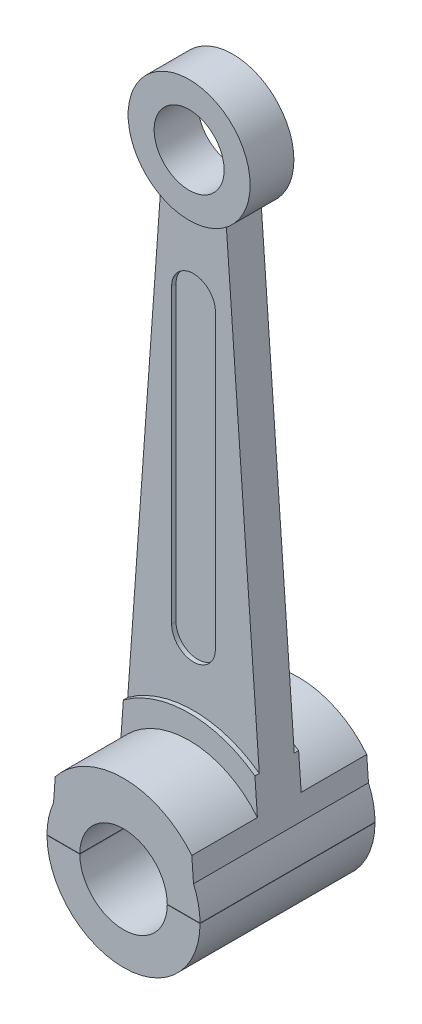
from build123d import *

# Parameters (mm, degrees)
SKETCH1_R                = 35.433
SKETCH1_R_2              = 20.32
BOSS_EXTRUDE1_DEPTH      = 12.7
SKETCH1_R_3              = 64.516
SKETCH1_R_4              = 25.4
BOSS_EXTRUDE1_2_DEPTH    = 12.7
BOSS_EXTRUDE2_DEPTH      = 10.16
BOSS_EXTRUDE3_DEPTH      = 7.62
BOSS_EXTRUDE4_DEPTH      = 38.1
BOSS_EXTRUDE4_DEPTH_BACK = 63.5
SKETCH2_R                = 50.8
SKETCH2_R_2              = 25.4
CUT_EXTRUDE1_DEPTH       = 81.28
SKETCH4_W                = 436.529729861
SKETCH4_H                = 0.2032
CUT_EXTRUDE2_DEPTH       = 81.28


with BuildPart() as part:
    # Sketch1 → Boss-Extrude1 (new, symmetric)
    with BuildSketch(Plane.XY):
        with Locations((0, 347.726)):
            Circle(SKETCH1_R)
        with Locations((0, 347.726)):
            Circle(SKETCH1_R_2, mode=Mode.SUBTRACT)
    extrude(amount=BOSS_EXTRUDE1_DEPTH, both=True)



with BuildPart() as body_2:
    # Sketch1 → Boss-Extrude1 2 (new, symmetric)
    with BuildSketch(Plane.XY):
        Circle(SKETCH1_R_3)
        Circle(SKETCH1_R_4, mode=Mode.SUBTRACT)
    extrude(amount=BOSS_EXTRUDE1_2_DEPTH, both=True)


with BuildPart() as part_1:
    add(part.part)

    add(body_2.part)  # Boss-Extrude2 merges body 2
    # Sketch1<3> → Boss-Extrude2 (add, symmetric)
    with BuildSketch(Plane.XY):
        with BuildLine():
            ThreePointArc((19.05, 317.849671762), (0, 312.293), (-19.05, 317.849671762))
            Line((-19.05, 317.849671762), (-41.91, 49.049629519))
            ThreePointArc((-41.91, 49.049629519), (0, 64.516), (41.91, 49.049629519))
            Line((41.91, 49.049629519), (19.05, 317.849671762))
        make_face()
        with BuildLine():
            ThreePointArc((-12.7, 271.526), (0, 284.226), (12.7, 271.526))
            Line((12.7, 271.526), (12.7, 101.6))
            ThreePointArc((12.7, 101.6), (0, 88.9), (-12.7, 101.6))
            Line((-12.7, 101.6), (-12.7, 271.526))
        make_face(mode=Mode.SUBTRACT)
    extrude(amount=BOSS_EXTRUDE2_DEPTH, both=True)

    # Sketch1<4> → Boss-Extrude3 (add, symmetric)
    with BuildSketch(Plane.XY):
        with BuildLine():
            Line((12.7, 101.6), (12.7, 271.526))
            ThreePointArc((12.7, 271.526), (0, 284.226), (-12.7, 271.526))
            Line((-12.7, 271.526), (-12.7, 101.6))
            ThreePointArc((-12.7, 101.6), (0, 88.9), (12.7, 101.6))
        make_face()
    extrude(amount=BOSS_EXTRUDE3_DEPTH, both=True)

    # Sketch2 → Boss-Extrude4 (add, two sides: drawn at the far end of the back side and taken through both)
    with BuildSketch(Plane.XY.offset(12.7).offset(-BOSS_EXTRUDE4_DEPTH_BACK)):
        Circle(SKETCH2_R)
        Circle(SKETCH2_R_2, mode=Mode.SUBTRACT)
    extrude(amount=BOSS_EXTRUDE4_DEPTH + BOSS_EXTRUDE4_DEPTH_BACK)

    # Sketch3 → Cut-Extrude1 (cut, symmetric)
    with BuildSketch(Plane.XY):
        with BuildLine():
            Line((-19.05, 317.849671762), (-70.876957171, 53.662528287))
            ThreePointArc((-70.876957171, 53.662528287), (0, -88.9), (70.876957171, 53.662528287))
            Line((70.876957171, 53.662528287), (19.05, 317.849671762))
            Line((19.05, 317.849671762), (40.64, 18.005357536))
            ThreePointArc((40.64, 18.005357536), (0, -44.45), (-40.64, 18.005357536))
            Line((-40.64, 18.005357536), (-19.05, 317.849671762))
        make_face()
    extrude(amount=CUT_EXTRUDE1_DEPTH, both=True, mode=Mode.SUBTRACT)

    # Sketch4 → Cut-Extrude2 (cut, symmetric)
    with BuildSketch(Plane.XY):
        with Locations((139.606166591, 0)):
            Rectangle(SKETCH4_W, SKETCH4_H)
    extrude(amount=CUT_EXTRUDE2_DEPTH, both=True, mode=Mode.SUBTRACT)


with BuildPart() as cut_extrude2_piece_1:
    # of the separate pieces the step leaves, piece 1, a body of its own (cut_extrude2_pieces)
    add(part_1.part.solids().sort_by_distance((38.192492502, 51.996613087, -12.7))[0])


with BuildPart() as cut_extrude2_piece_2:
    # of the separate pieces the step leaves, piece 2, a body of its own (cut_extrude2_pieces)
    add(part_1.part.solids().sort_by_distance((-44.449883886, -0.1016, -50.8))[0])


solid = Compound([cut_extrude2_piece_1.part, cut_extrude2_piece_2.part])
